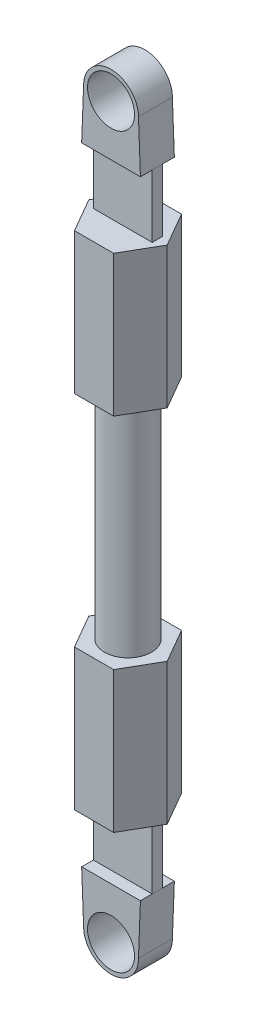
from build123d import *

# Parameters (mm, degrees)
BOSS_EXTRUDE1_DEPTH = 9
SKETCH2_R           = 1.5
BOSS_EXTRUDE2_DEPTH = 7
SKETCH3_W           = 3.75
SKETCH3_H           = 2.16506351
BOSS_EXTRUDE3_DEPTH = 9
SKETCH4_W           = 0.75
SKETCH4_H           = 4
CUT_EXTRUDE1_DEPTH  = 19.650150804
SKETCH5_R           = 1.5
CUT_EXTRUDE2_DEPTH  = 19.460684576


with BuildPart() as part:
    # Sketch1 → Boss-Extrude1 (new body)
    with BuildSketch(Plane(origin=(0, 0, 0), x_dir=(1, 0, 0), z_dir=(0, 1, 0))):
        Polygon((2.5, 0), (1.25, 2.165063509), (-1.25, 2.165063509), (-2.5, 0), (-1.25, -2.165063509), (1.25, -2.165063509), align=None)
    extrude(amount=BOSS_EXTRUDE1_DEPTH)

    # Sketch2 → Boss-Extrude2 (add)
    with BuildSketch(Plane.XZ):
        with Locations(Location((0, 0, 0), (0, 0, 270))):
            Circle(SKETCH2_R)
    extrude(amount=BOSS_EXTRUDE2_DEPTH)

    # Sketch3 → Boss-Extrude3 (add)
    with BuildSketch(Plane(origin=(0, 9, 0), x_dir=(1, 0, 0), z_dir=(0, 1, 0))):
        Rectangle(SKETCH3_W, SKETCH3_H)
    extrude(amount=BOSS_EXTRUDE3_DEPTH)

    # Sketch4 → Cut-Extrude1 (cut, through all)
    with BuildSketch(Plane.ZY.offset(1.875)):
        with Locations((-0.707531755, 11)):
            Rectangle(SKETCH4_W, SKETCH4_H)
        with Locations((0.707531755, 11)):
            Rectangle(SKETCH4_W, SKETCH4_H)
    extrude(amount=-CUT_EXTRUDE1_DEPTH, mode=Mode.SUBTRACT)

    # Sketch5 → Cut-Extrude2 (cut, through all)
    with BuildSketch(Plane(origin=(0, 0, -1.082531755), x_dir=(-1, 0, 0), z_dir=(0, 0, -1))):
        with Locations((0, 16.25)):
            Circle(SKETCH5_R)
        with BuildLine():
            ThreePointArc((-1.75, 16.25), (-1.237436867, 17.487436868), (2e-09, 18))
            Line((2e-09, 18), (-1.875, 18))
            Line((-1.875, 18), (-1.875, 13))
            Line((-1.875, 13), (-1.75, 16.25))
        make_face()
        with BuildLine():
            ThreePointArc((2e-09, 18), (1.237436868, 17.487436867), (1.75, 16.25))
            Line((1.75, 16.25), (1.875, 13))
            Line((1.875, 13), (1.875, 18))
            Line((1.875, 18), (2e-09, 18))
        make_face()
    extrude(amount=-CUT_EXTRUDE2_DEPTH, mode=Mode.SUBTRACT)

    # Mirror1: part across plane


with BuildPart() as part_1:
    add(part.part)
    add(part.part.mirror(Plane(origin=(0, -7, 0), x_dir=(0, 0, 1), z_dir=(0, -1, 0))))


solid = part_1.part
